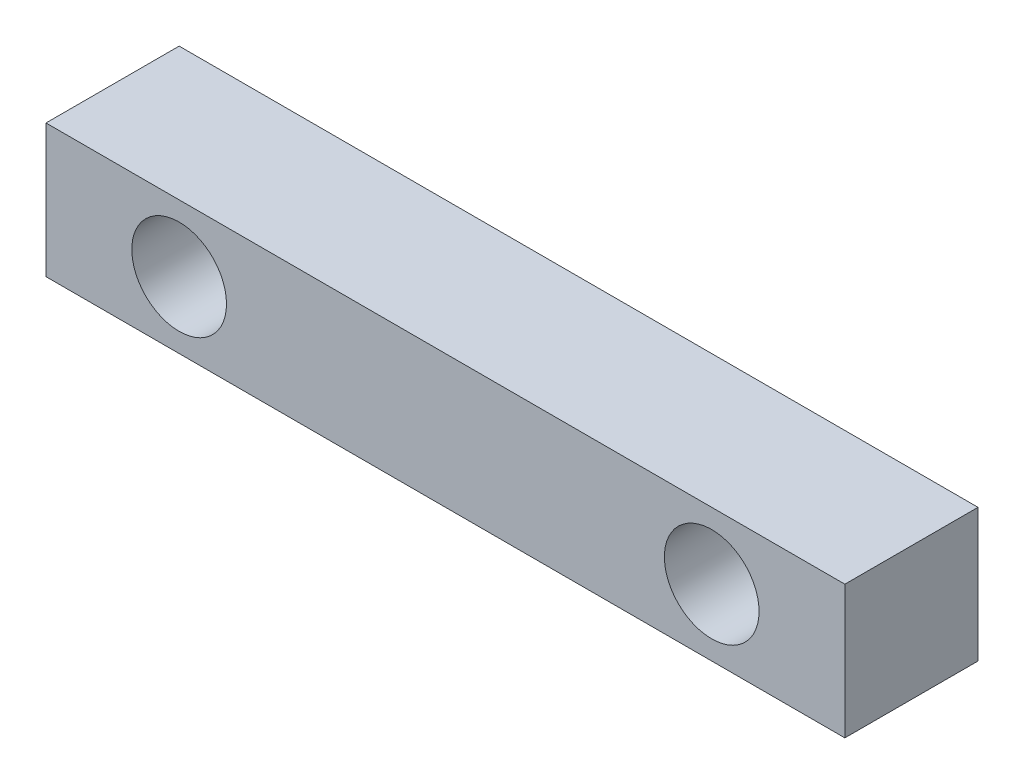
from build123d import *

# Parameters (mm, degrees)
SKETCH1_W                    = 30
SKETCH1_H                    = 5
BOSS_EXTRUDE1_DEPTH          = 5
F_5_32_0_14_DIAMETER_HOLE1_D = 3.556


with BuildPart() as part:
    # Sketch1 → Boss-Extrude1 (new body)
    with BuildSketch(Plane.XY):
        Rectangle(SKETCH1_W, SKETCH1_H)
    extrude(amount=BOSS_EXTRUDE1_DEPTH)

    # 5/32 (0.14) Diameter Hole1 (through all)
    with Locations(Plane.XY.offset(5)):
        with Locations((-10, 0), (10, 0)):
            Hole(F_5_32_0_14_DIAMETER_HOLE1_D / 2)


solid = part.part
